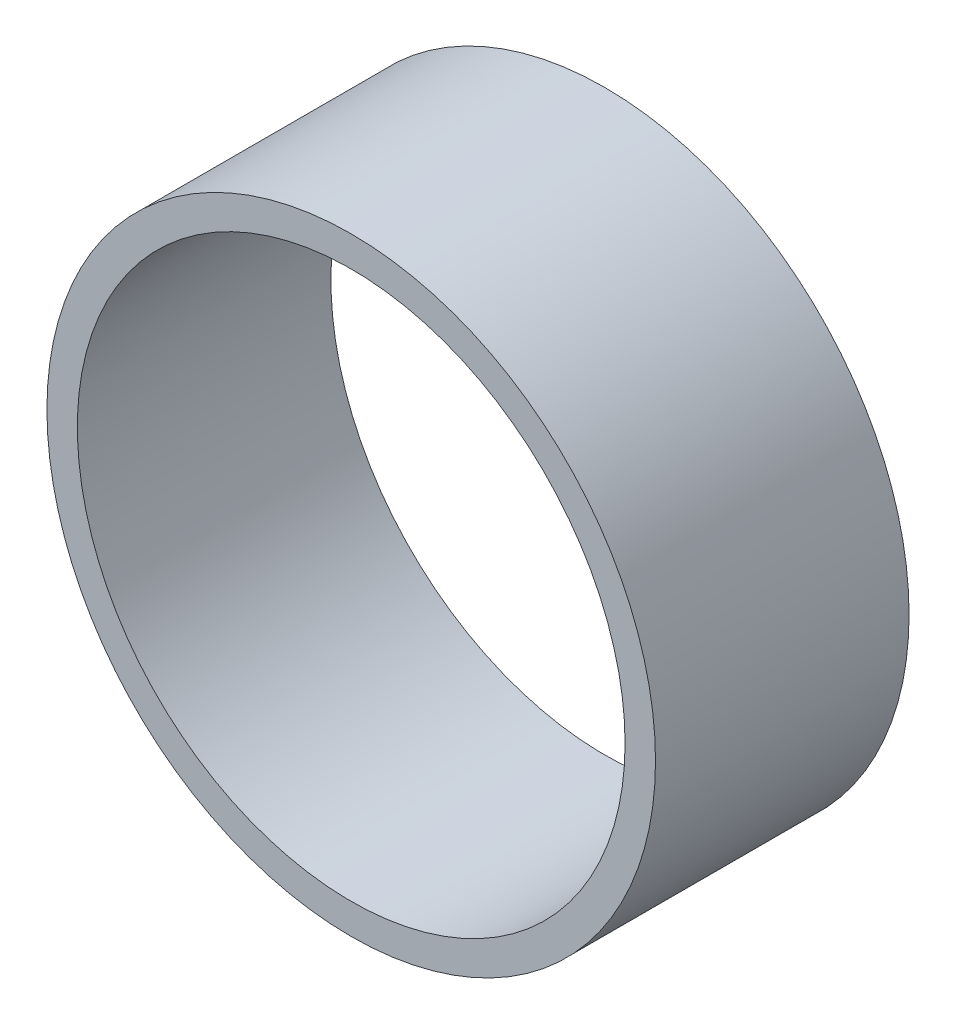
from build123d import *

# Parameters (mm, degrees)
ESQUISSE1_R        = 30
ESQUISSE1_R_2      = 27
BOSS_EXTRU_1_DEPTH = 25


with BuildPart() as part:
    # Esquisse1 → Boss.-Extru.1 (new body)
    with BuildSketch(Plane.XY):
        Circle(ESQUISSE1_R)
        Circle(ESQUISSE1_R_2, mode=Mode.SUBTRACT)
    extrude(amount=BOSS_EXTRU_1_DEPTH)


solid = part.part
